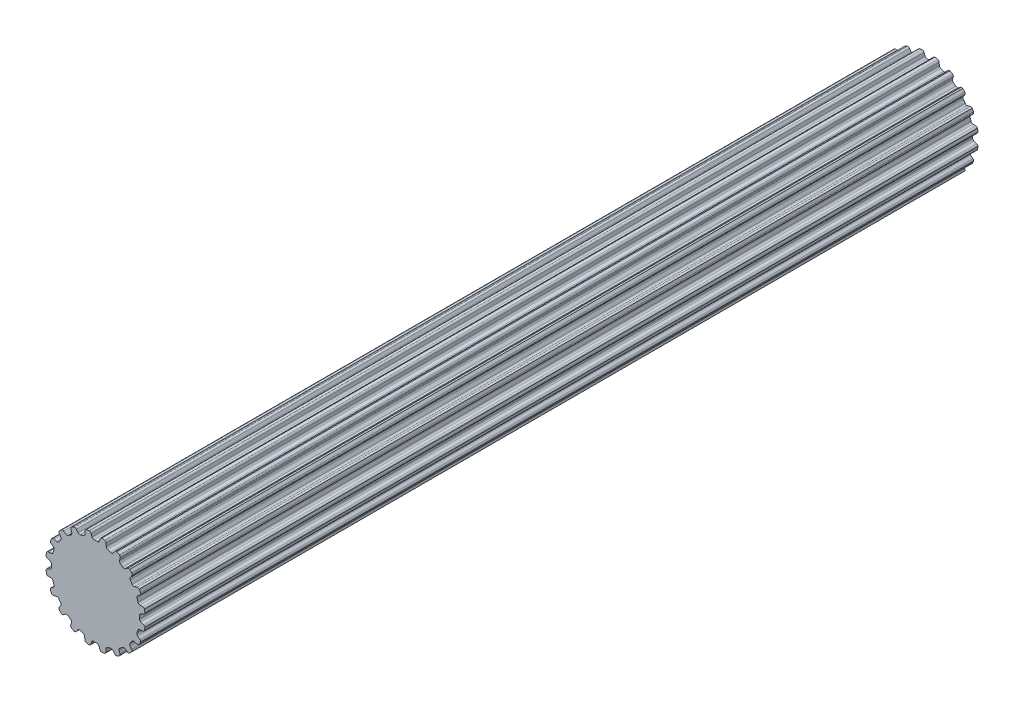
from build123d import *

# Parameters (mm, degrees)
BOSS_EXTRUDE1_DEPTH = 28.0035


with BuildPart() as part:
    # Sketch1 → Boss-Extrude1 (new, symmetric)
    with BuildSketch(Plane.XY):
        with BuildLine():
            Line((-0.106949245, 2.969874934), (0.106949245, 2.969874934))
            ThreePointArc((0.106949245, 2.969874934), (0.196343213, 2.986924176), (0.253739238, 3.057547504))
            Line((0.253739238, 3.057547504), (0.315888147, 3.237526941))
            ThreePointArc((0.315888147, 3.237526941), (0.359032156, 3.298322911), (0.4281449, 3.326269005))
            Line((0.4281449, 3.326269005), (0.620027588, 3.2937547))
            ThreePointArc((0.620027588, 3.2937547), (0.689621142, 3.24802576), (0.718272212, 3.169836791))
            Line((0.718272212, 3.169836791), (0.724389167, 2.979527391))
            ThreePointArc((0.724389167, 2.979527391), (0.750934762, 2.9040661), (0.816027049, 2.857568043))
            Line((0.816027049, 2.857568043), (1.019456602, 2.791469774))
            ThreePointArc((1.019456602, 2.791469774), (1.109743823, 2.780060312), (1.186154496, 2.829490741))
            Line((1.186154496, 2.829490741), (1.300878326, 2.981456288))
            ThreePointArc((1.300878326, 2.981456288), (1.360697704, 3.02594446), (1.435063648, 3.031165762))
            Line((1.435063648, 3.031165762), (1.607507455, 2.940947809))
            ThreePointArc((1.607507455, 2.940947809), (1.659563839, 2.875951412), (1.662650905, 2.792735615))
            Line((1.662650905, 2.792735615), (1.609659636, 2.609850378))
            ThreePointArc((1.609659636, 2.609850378), (1.611587176, 2.529879385), (1.659124931, 2.465542482))
            Line((1.659124931, 2.465542482), (1.832172444, 2.339816104))
            ThreePointArc((1.832172444, 2.339816104), (1.914514976, 2.301064775), (2.002460687, 2.32446371))
            Line((2.002460687, 2.32446371), (2.158529469, 2.433539921))
            ThreePointArc((2.158529469, 2.433539921), (2.229168681, 2.457365482), (2.301508367, 2.439350895))
            Line((2.301508367, 2.439350895), (2.437633293, 2.300260456))
            ThreePointArc((2.437633293, 2.300260456), (2.467056864, 2.222358901), (2.444277744, 2.14226202))
            Line((2.444277744, 2.14226202), (2.337365406, 1.984703026))
            ThreePointArc((2.337365406, 1.984703026), (2.314486209, 1.908050449), (2.339816104, 1.832172444))
            Line((2.339816104, 1.832172444), (2.465542482, 1.659124931))
            ThreePointArc((2.465542482, 1.659124931), (2.531880064, 1.596824985), (2.622752074, 1.591901975))
            Line((2.622752074, 1.591901975), (2.804888709, 1.64741171))
            ThreePointArc((2.804888709, 1.64741171), (2.879433095, 1.648242449), (2.942665411, 1.608755366))
            Line((2.942665411, 1.608755366), (3.0291466, 1.434407582))
            ThreePointArc((3.0291466, 1.434407582), (3.033057175, 1.351226417), (2.986641646, 1.282088892))
            Line((2.986641646, 1.282088892), (2.836273564, 1.165279113))
            ThreePointArc((2.836273564, 1.165279113), (2.790827206, 1.099448241), (2.791469774, 1.019456602))
            Line((2.791469774, 1.019456602), (2.857568043, 0.816027049))
            ThreePointArc((2.857568043, 0.816027049), (2.901407091, 0.736276839), (2.986310214, 0.703513784))
            Line((2.986310214, 0.703513784), (3.1766859, 0.700023363))
            ThreePointArc((3.1766859, 0.700023363), (3.247838536, 0.677777961), (3.295773863, 0.620683653))
            Line((3.295773863, 0.620683653), (3.324145932, 0.4281449))
            ThreePointArc((3.324145932, 0.4281449), (3.302160717, 0.347826477), (3.236652255, 0.29641597))
            Line((3.236652255, 0.29641597), (3.057547504, 0.231789562))
            ThreePointArc((3.057547504, 0.231789562), (2.993982591, 0.183224379), (2.969874934, 0.106949245))
            Line((2.969874934, 0.106949245), (2.969874934, -0.106949245))
            ThreePointArc((2.969874934, -0.106949245), (2.986924176, -0.196343213), (3.057547504, -0.253739238))
            Line((3.057547504, -0.253739238), (3.237526941, -0.315888147))
            ThreePointArc((3.237526941, -0.315888147), (3.298322911, -0.359032156), (3.326269005, -0.4281449))
            Line((3.326269005, -0.4281449), (3.2937547, -0.620027588))
            ThreePointArc((3.2937547, -0.620027588), (3.24802576, -0.689621142), (3.169836791, -0.718272212))
            Line((3.169836791, -0.718272212), (2.979527391, -0.724389167))
            ThreePointArc((2.979527391, -0.724389167), (2.9040661, -0.750934762), (2.857568043, -0.816027049))
            Line((2.857568043, -0.816027049), (2.791469774, -1.019456602))
            ThreePointArc((2.791469774, -1.019456602), (2.780060312, -1.109743823), (2.829490741, -1.186154496))
            Line((2.829490741, -1.186154496), (2.981456288, -1.300878326))
            ThreePointArc((2.981456288, -1.300878326), (3.02594446, -1.360697704), (3.031165762, -1.435063648))
            Line((3.031165762, -1.435063648), (2.940947809, -1.607507455))
            ThreePointArc((2.940947809, -1.607507455), (2.875951412, -1.659563839), (2.792735615, -1.662650905))
            Line((2.792735615, -1.662650905), (2.609850378, -1.609659636))
            ThreePointArc((2.609850378, -1.609659636), (2.529879385, -1.611587176), (2.465542482, -1.659124931))
            Line((2.465542482, -1.659124931), (2.339816104, -1.832172444))
            ThreePointArc((2.339816104, -1.832172444), (2.301064775, -1.914514976), (2.32446371, -2.002460687))
            Line((2.32446371, -2.002460687), (2.433539921, -2.158529469))
            ThreePointArc((2.433539921, -2.158529469), (2.457365482, -2.229168681), (2.439350895, -2.301508367))
            Line((2.439350895, -2.301508367), (2.300260456, -2.437633293))
            ThreePointArc((2.300260456, -2.437633293), (2.222358901, -2.467056864), (2.14226202, -2.444277744))
            Line((2.14226202, -2.444277744), (1.984703026, -2.337365406))
            ThreePointArc((1.984703026, -2.337365406), (1.908050449, -2.314486209), (1.832172444, -2.339816104))
            Line((1.832172444, -2.339816104), (1.659124931, -2.465542482))
            ThreePointArc((1.659124931, -2.465542482), (1.596824985, -2.531880064), (1.591901975, -2.622752074))
            Line((1.591901975, -2.622752074), (1.64741171, -2.804888709))
            ThreePointArc((1.64741171, -2.804888709), (1.648242449, -2.879433095), (1.608755366, -2.942665411))
            Line((1.608755366, -2.942665411), (1.434407582, -3.0291466))
            ThreePointArc((1.434407582, -3.0291466), (1.351226417, -3.033057175), (1.282088892, -2.986641646))
            Line((1.282088892, -2.986641646), (1.165279113, -2.836273564))
            ThreePointArc((1.165279113, -2.836273564), (1.099448241, -2.790827206), (1.019456602, -2.791469774))
            Line((1.019456602, -2.791469774), (0.816027049, -2.857568043))
            ThreePointArc((0.816027049, -2.857568043), (0.736276839, -2.901407091), (0.703513784, -2.986310214))
            Line((0.703513784, -2.986310214), (0.700023363, -3.1766859))
            ThreePointArc((0.700023363, -3.1766859), (0.677777961, -3.247838536), (0.620683653, -3.295773863))
            Line((0.620683653, -3.295773863), (0.4281449, -3.324145932))
            ThreePointArc((0.4281449, -3.324145932), (0.347826477, -3.302160717), (0.29641597, -3.236652255))
            Line((0.29641597, -3.236652255), (0.231789562, -3.057547504))
            ThreePointArc((0.231789562, -3.057547504), (0.183224379, -2.993982591), (0.106949245, -2.969874934))
            Line((0.106949245, -2.969874934), (-0.106949245, -2.969874934))
            ThreePointArc((-0.106949245, -2.969874934), (-0.196343213, -2.986924176), (-0.253739238, -3.057547504))
            Line((-0.253739238, -3.057547504), (-0.315888147, -3.237526941))
            ThreePointArc((-0.315888147, -3.237526941), (-0.359032156, -3.298322911), (-0.4281449, -3.326269005))
            Line((-0.4281449, -3.326269005), (-0.620027588, -3.2937547))
            ThreePointArc((-0.620027588, -3.2937547), (-0.689621142, -3.24802576), (-0.718272212, -3.169836791))
            Line((-0.718272212, -3.169836791), (-0.724389167, -2.979527391))
            ThreePointArc((-0.724389167, -2.979527391), (-0.750934762, -2.9040661), (-0.816027049, -2.857568043))
            Line((-0.816027049, -2.857568043), (-1.019456602, -2.791469774))
            ThreePointArc((-1.019456602, -2.791469774), (-1.109743823, -2.780060312), (-1.186154496, -2.829490741))
            Line((-1.186154496, -2.829490741), (-1.300878326, -2.981456288))
            ThreePointArc((-1.300878326, -2.981456288), (-1.360697704, -3.02594446), (-1.435063648, -3.031165762))
            Line((-1.435063648, -3.031165762), (-1.607507455, -2.940947809))
            ThreePointArc((-1.607507455, -2.940947809), (-1.659563839, -2.875951412), (-1.662650905, -2.792735615))
            Line((-1.662650905, -2.792735615), (-1.609659636, -2.609850378))
            ThreePointArc((-1.609659636, -2.609850378), (-1.611587176, -2.529879385), (-1.659124931, -2.465542482))
            Line((-1.659124931, -2.465542482), (-1.832172444, -2.339816104))
            ThreePointArc((-1.832172444, -2.339816104), (-1.914514976, -2.301064775), (-2.002460687, -2.32446371))
            Line((-2.002460687, -2.32446371), (-2.158529469, -2.433539921))
            ThreePointArc((-2.158529469, -2.433539921), (-2.229168681, -2.457365482), (-2.301508367, -2.439350895))
            Line((-2.301508367, -2.439350895), (-2.437633293, -2.300260456))
            ThreePointArc((-2.437633293, -2.300260456), (-2.467056864, -2.222358901), (-2.444277744, -2.14226202))
            Line((-2.444277744, -2.14226202), (-2.337365406, -1.984703026))
            ThreePointArc((-2.337365406, -1.984703026), (-2.314486209, -1.908050449), (-2.339816104, -1.832172444))
            Line((-2.339816104, -1.832172444), (-2.465542482, -1.659124931))
            ThreePointArc((-2.465542482, -1.659124931), (-2.531880064, -1.596824985), (-2.622752074, -1.591901975))
            Line((-2.622752074, -1.591901975), (-2.804888709, -1.64741171))
            ThreePointArc((-2.804888709, -1.64741171), (-2.879433095, -1.648242449), (-2.942665411, -1.608755366))
            Line((-2.942665411, -1.608755366), (-3.0291466, -1.434407582))
            ThreePointArc((-3.0291466, -1.434407582), (-3.033057175, -1.351226417), (-2.986641646, -1.282088892))
            Line((-2.986641646, -1.282088892), (-2.836273564, -1.165279113))
            ThreePointArc((-2.836273564, -1.165279113), (-2.790827206, -1.099448241), (-2.791469774, -1.019456602))
            Line((-2.791469774, -1.019456602), (-2.857568043, -0.816027049))
            ThreePointArc((-2.857568043, -0.816027049), (-2.901407091, -0.736276839), (-2.986310214, -0.703513784))
            Line((-2.986310214, -0.703513784), (-3.1766859, -0.700023363))
            ThreePointArc((-3.1766859, -0.700023363), (-3.247838536, -0.677777961), (-3.295773863, -0.620683653))
            Line((-3.295773863, -0.620683653), (-3.324145932, -0.4281449))
            ThreePointArc((-3.324145932, -0.4281449), (-3.302160717, -0.347826477), (-3.236652255, -0.29641597))
            Line((-3.236652255, -0.29641597), (-3.057547504, -0.231789562))
            ThreePointArc((-3.057547504, -0.231789562), (-2.993982591, -0.183224379), (-2.969874934, -0.106949245))
            Line((-2.969874934, -0.106949245), (-2.969874934, 0.106949245))
            ThreePointArc((-2.969874934, 0.106949245), (-2.986924176, 0.196343213), (-3.057547504, 0.253739238))
            Line((-3.057547504, 0.253739238), (-3.237526941, 0.315888147))
            ThreePointArc((-3.237526941, 0.315888147), (-3.298322911, 0.359032156), (-3.326269005, 0.4281449))
            Line((-3.326269005, 0.4281449), (-3.2937547, 0.620027588))
            ThreePointArc((-3.2937547, 0.620027588), (-3.24802576, 0.689621142), (-3.169836791, 0.718272212))
            Line((-3.169836791, 0.718272212), (-2.979527391, 0.724389167))
            ThreePointArc((-2.979527391, 0.724389167), (-2.9040661, 0.750934762), (-2.857568043, 0.816027049))
            Line((-2.857568043, 0.816027049), (-2.791469774, 1.019456602))
            ThreePointArc((-2.791469774, 1.019456602), (-2.780060312, 1.109743823), (-2.829490741, 1.186154496))
            Line((-2.829490741, 1.186154496), (-2.981456288, 1.300878326))
            ThreePointArc((-2.981456288, 1.300878326), (-3.02594446, 1.360697704), (-3.031165762, 1.435063648))
            Line((-3.031165762, 1.435063648), (-2.940947809, 1.607507455))
            ThreePointArc((-2.940947809, 1.607507455), (-2.875951412, 1.659563839), (-2.792735615, 1.662650905))
            Line((-2.792735615, 1.662650905), (-2.609850378, 1.609659636))
            ThreePointArc((-2.609850378, 1.609659636), (-2.529879385, 1.611587176), (-2.465542482, 1.659124931))
            Line((-2.465542482, 1.659124931), (-2.339816104, 1.832172444))
            ThreePointArc((-2.339816104, 1.832172444), (-2.301064775, 1.914514976), (-2.32446371, 2.002460687))
            Line((-2.32446371, 2.002460687), (-2.433539921, 2.158529469))
            ThreePointArc((-2.433539921, 2.158529469), (-2.457365482, 2.229168681), (-2.439350895, 2.301508367))
            Line((-2.439350895, 2.301508367), (-2.300260456, 2.437633293))
            ThreePointArc((-2.300260456, 2.437633293), (-2.222358901, 2.467056864), (-2.14226202, 2.444277744))
            Line((-2.14226202, 2.444277744), (-1.984703026, 2.337365406))
            ThreePointArc((-1.984703026, 2.337365406), (-1.908050449, 2.314486209), (-1.832172444, 2.339816104))
            Line((-1.832172444, 2.339816104), (-1.659124931, 2.465542482))
            ThreePointArc((-1.659124931, 2.465542482), (-1.596824985, 2.531880064), (-1.591901975, 2.622752074))
            Line((-1.591901975, 2.622752074), (-1.64741171, 2.804888709))
            ThreePointArc((-1.64741171, 2.804888709), (-1.648242449, 2.879433095), (-1.608755366, 2.942665411))
            Line((-1.608755366, 2.942665411), (-1.434407582, 3.0291466))
            ThreePointArc((-1.434407582, 3.0291466), (-1.351226417, 3.033057175), (-1.282088892, 2.986641646))
            Line((-1.282088892, 2.986641646), (-1.165279113, 2.836273564))
            ThreePointArc((-1.165279113, 2.836273564), (-1.099448241, 2.790827206), (-1.019456602, 2.791469774))
            Line((-1.019456602, 2.791469774), (-0.816027049, 2.857568043))
            ThreePointArc((-0.816027049, 2.857568043), (-0.736276839, 2.901407091), (-0.703513784, 2.986310214))
            Line((-0.703513784, 2.986310214), (-0.700023363, 3.1766859))
            ThreePointArc((-0.700023363, 3.1766859), (-0.677777961, 3.247838536), (-0.620683653, 3.295773863))
            Line((-0.620683653, 3.295773863), (-0.4281449, 3.324145932))
            ThreePointArc((-0.4281449, 3.324145932), (-0.347826477, 3.302160717), (-0.29641597, 3.236652255))
            Line((-0.29641597, 3.236652255), (-0.231789562, 3.057547504))
            ThreePointArc((-0.231789562, 3.057547504), (-0.183224379, 2.993982591), (-0.106949245, 2.969874934))
        make_face()
    extrude(amount=BOSS_EXTRUDE1_DEPTH, both=True)


solid = part.part
